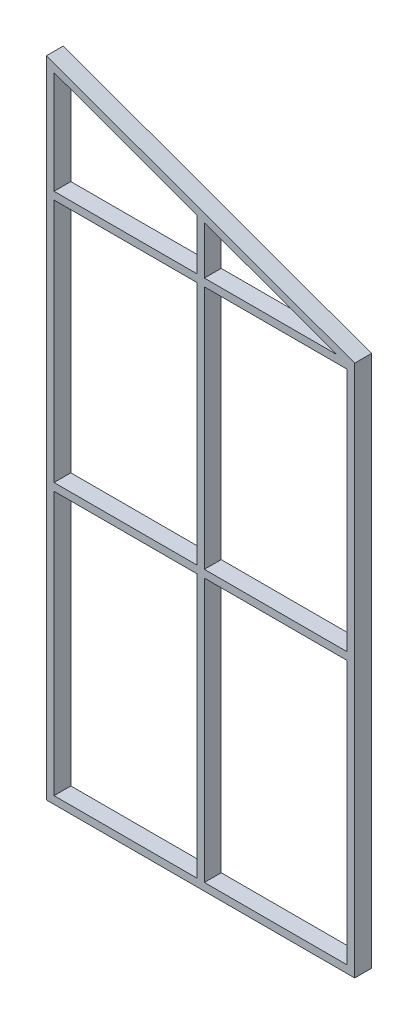
from build123d import *

# Parameters (mm, degrees)
BOSS_EXTRU_1_DEPTH = 60
ESQUISSE2_W        = 27
ESQUISSE2_H        = 2063
ESQUISSE2_W_2      = 1046
ESQUISSE2_H_2      = 27
EXTRU_MINCE1_DEPTH = 60


with BuildPart() as part:
    # Esquisse1 → Boss.-Extru.1 (new body)
    with BuildSketch(Plane.XY):
        Polygon((0, 0), (1100, 0), (1100, 1900), (0, 2300), align=None)
        Polygon((27, 27), (1073, 27), (1073, 1881.088463856), (27, 2261.452100219), align=None, mode=Mode.SUBTRACT)
    extrude(amount=BOSS_EXTRU_1_DEPTH)

    # Esquisse2 → Extru.-Mince1 (add)
    with BuildSketch(Plane.XY.offset(60)):
        with Locations((550, 1058.5)):
            Rectangle(ESQUISSE2_W, ESQUISSE2_H)
        with Locations((550, 1881.088463856)):
            Rectangle(ESQUISSE2_W_2, ESQUISSE2_H_2)
        with Locations((550, 981.088463856)):
            Rectangle(ESQUISSE2_W_2, ESQUISSE2_H_2)
    extrude(amount=-EXTRU_MINCE1_DEPTH)


solid = part.part
